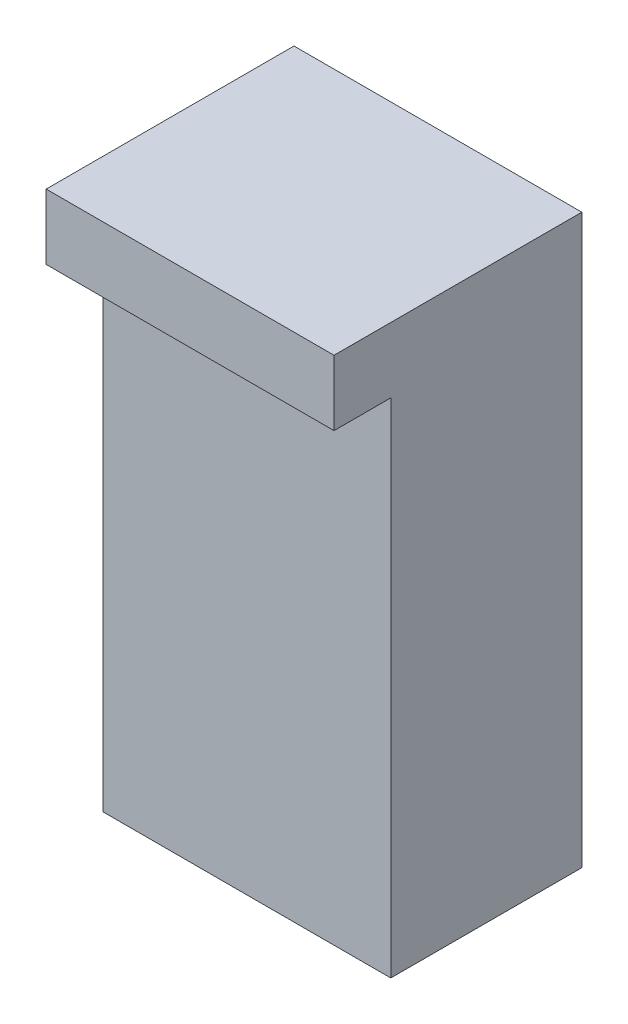
from build123d import *

# Parameters (mm, degrees)
SKETCH1_W           = 25.7556
SKETCH1_H           = 17.0942
BOSS_EXTRUDE1_DEPTH = 50.8
SKETCH2_W           = 25.7556
SKETCH2_H           = 5.842
BOSS_EXTRUDE2_DEPTH = 5.08


with BuildPart() as part:
    # Sketch1 → Boss-Extrude1 (new body)
    with BuildSketch(Plane(origin=(0, 0, 0), x_dir=(1, 0, 0), z_dir=(0, 1, 0))):
        Rectangle(SKETCH1_W, SKETCH1_H)
    extrude(amount=BOSS_EXTRUDE1_DEPTH)

    # Sketch2 → Boss-Extrude2 (add)
    with BuildSketch(Plane.XY.offset(8.5471)):
        with Locations((0, 47.879)):
            Rectangle(SKETCH2_W, SKETCH2_H)
    extrude(amount=BOSS_EXTRUDE2_DEPTH)


solid = part.part
